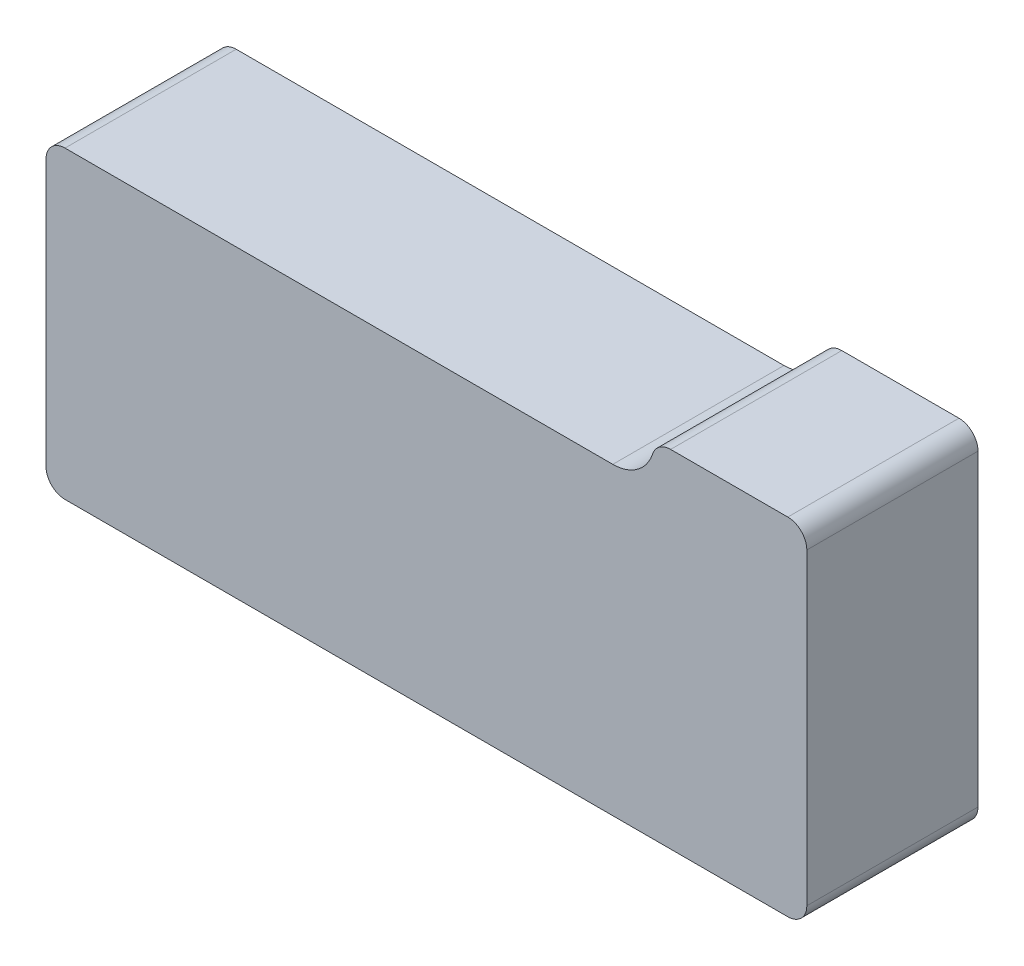
from build123d import *

# Parameters (mm, degrees)
EXTRUDE1_DEPTH = 45


with BuildPart() as part:
    # Sketch1 → Extrude1 (new body)
    with BuildSketch(Plane.XY):
        with BuildLine():
            Line((-95, 40), (49, 40))
            ThreePointArc((49, 40), (55.44932167, 42.08898154), (59.449095356, 47.5625))
            ThreePointArc((59.449095356, 47.5625), (61.267174304, 50.050462937), (64.198684154, 51))
            Line((64.198684154, 51), (95, 51))
            ThreePointArc((95, 51), (98.535533906, 49.535533906), (100, 46))
            Line((100, 46), (100, -35))
            ThreePointArc((100, -35), (98.535533906, -38.535533906), (95, -40))
            Line((95, -40), (-95, -40))
            ThreePointArc((-95, -40), (-98.535533906, -38.535533906), (-100, -35))
            Line((-100, -35), (-100, 35))
            ThreePointArc((-100, 35), (-98.535533906, 38.535533906), (-95, 40))
        make_face()
    extrude(amount=EXTRUDE1_DEPTH)


solid = part.part
